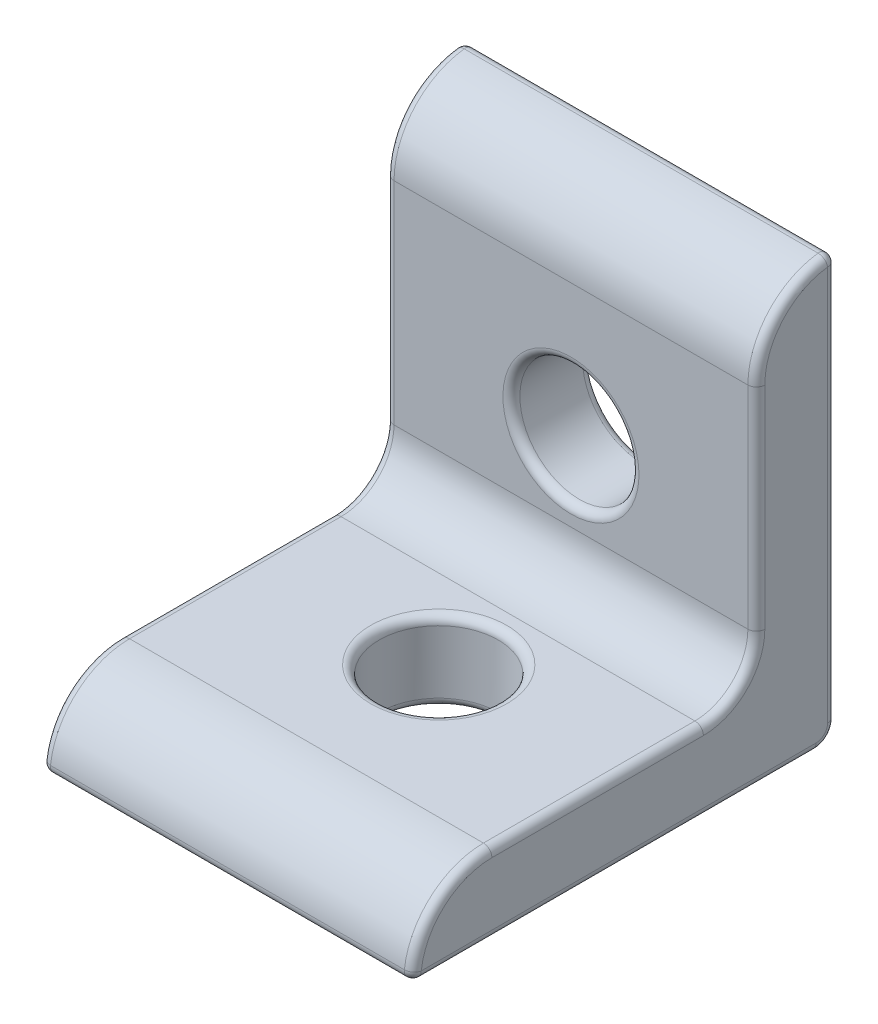
from build123d import *

# Parameters (mm, degrees)
BOSS_EXTRUDE1_START = 11.1125
BOSS_EXTRUDE1_DEPTH = 22.225
FILLET1_R           = 1.1938
SKETCH4_R           = 3.5687
CUT_EXTRUDE1_DEPTH  = 27.648827953
SKETCH5_R           = 3.5687
CUT_EXTRUDE2_DEPTH  = 32.213016617
FILLET2_R           = 0.508
FILLET3_R           = 0.508


with BuildPart() as part:
    # Sketch3 → Boss-Extrude1 (new body)
    with BuildSketch(Plane(origin=(0, 0, 0), x_dir=(0, 0, -1), z_dir=(1, 0, 0)).offset(BOSS_EXTRUDE1_START)):
        with BuildLine():
            Line((-3.175, -7.9248), (-15.8496, -7.9248))
            ThreePointArc((-15.8496, -7.9248), (-19.226176302, -9.323423698), (-20.6248, -12.7))
            Line((-20.6248, -12.7), (4.7752, -12.7))
            Line((4.7752, -12.7), (4.7752, 12.7))
            ThreePointArc((4.7752, 12.7), (1.398623698, 11.301376302), (0, 7.9248))
            Line((0, 7.9248), (0, -4.7498))
            ThreePointArc((0, -4.7498), (-0.92993597, -6.99486403), (-3.175, -7.9248))
        make_face()
    extrude(amount=-BOSS_EXTRUDE1_DEPTH)

    # Fillet1
    fillet1_edges = [part.edges().sort_by_distance(p)[0] for p in [
        (0, -12.7, -4.7752),
    ]]
    fillet(fillet1_edges, radius=FILLET1_R)

    # Sketch4 → Cut-Extrude1 (cut, through all)
    with BuildSketch(Plane.XY):
        Circle(SKETCH4_R)
    extrude(amount=-CUT_EXTRUDE1_DEPTH, mode=Mode.SUBTRACT)

    # Sketch5 → Cut-Extrude2 (cut, through all)
    with BuildSketch(Plane(origin=(0, -7.9248, 0), x_dir=(1, 0, 0), z_dir=(0, 1, 0))):
        with Locations(Location((0, -7.9248, 0), (0, 0, 270))):
            Circle(SKETCH5_R)
    extrude(amount=-CUT_EXTRUDE2_DEPTH, mode=Mode.SUBTRACT)

    # Fillet2
    fillet2_edges = [part.edges().sort_by_distance(p)[0] for p in [
        (0, 12.7, -4.7752),
        (0, -12.7, 20.6248),
        (-11.1125, 11.301376302, -1.398623698),
        (-11.1125, 1.5875, 0),
        (-11.1125, -6.99486403, 0.92993597),
        (11.1125, 0.5969, -4.7752),
        (-11.1125, -7.9248, 9.5123),
        (11.1125, -12.350344075, -4.425544075),
        (-11.1125, 0.5969, -4.7752),
        (-11.1125, -12.350344075, -4.425544075),
        (0, -12.7, 4.3561),
        (-11.1125, -9.323423698, 19.226176302),
        (11.1125, -7.9248, 9.5123),
        (-11.1125, -12.7, 8.5217),
        (11.1125, -6.99486403, 0.92993597),
        (11.1125, 1.5875, 0),
        (11.1125, 11.301376302, -1.398623698),
        (11.1125, -12.7, 8.5217),
        (11.1125, -9.323423698, 19.226176302),
    ]]
    fillet(fillet2_edges, radius=FILLET2_R)

    # Fillet3
    fillet3_edges = [part.edges().sort_by_distance(p)[0] for p in [
        (-3.5687, 0, -4.7752),
        (-3.5687, 0, 0),
        (0, -7.9248, 4.3561),
    ]]
    fillet(fillet3_edges, radius=FILLET3_R)


solid = part.part
